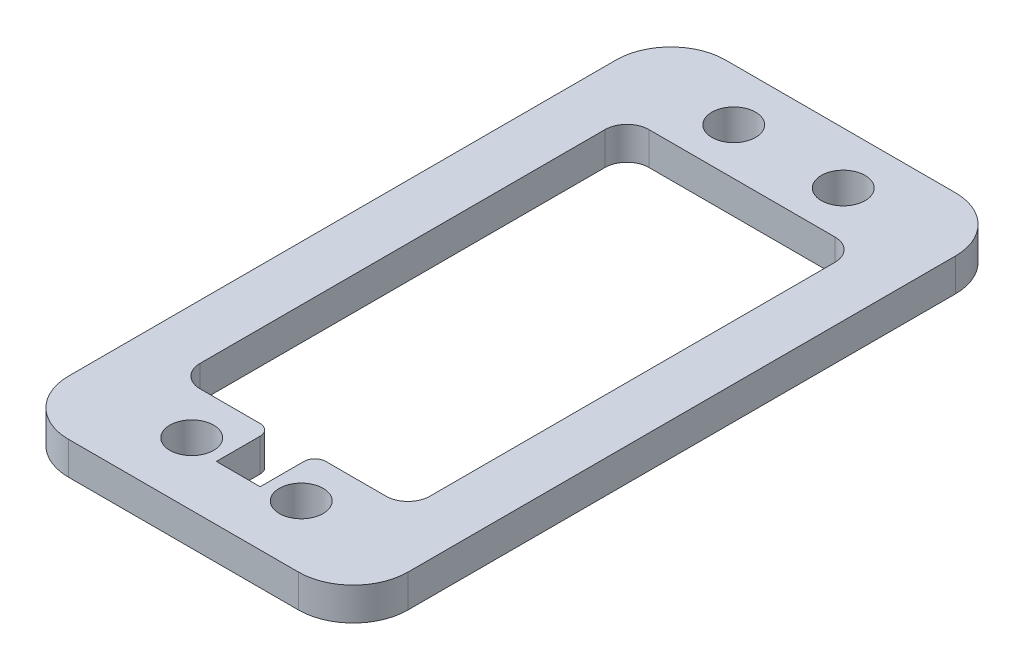
from build123d import *

# Parameters (mm, degrees)
SKETCH1_R           = 2
BOSS_EXTRUDE1_DEPTH = 3


with BuildPart() as part:
    # Sketch1 → Boss-Extrude1 (new body)
    with BuildSketch(Plane(origin=(0, 0, 0), x_dir=(1, 0, 0), z_dir=(0, 1, 0))):
        with BuildLine():
            ThreePointArc((-15.5, 34.4), (-14.035533906, 37.935533906), (-10.5, 39.4))
            Line((-10.5, 39.4), (10.5, 39.4))
            ThreePointArc((10.5, 39.4), (14.035533906, 37.935533906), (15.5, 34.4))
            Line((15.5, 34.4), (15.5, -15.6))
            ThreePointArc((15.5, -15.6), (14.035533906, -19.135533906), (10.5, -20.6))
            Line((10.5, -20.6), (-10.5, -20.6))
            ThreePointArc((-10.5, -20.6), (-14.035533906, -19.135533906), (-15.5, -15.6))
            Line((-15.5, -15.6), (-15.5, 34.4))
        make_face()
        with Locations(Location((5, -14.85, 0), (0, 0, 270))):
            Circle(SKETCH1_R, mode=Mode.SUBTRACT)
        with Locations(Location((-5, -14.85, 0), (0, 0, 270))):
            Circle(SKETCH1_R, mode=Mode.SUBTRACT)
        with Locations(Location((5, 34.65, 0), (0, 0, 270))):
            Circle(SKETCH1_R, mode=Mode.SUBTRACT)
        with Locations(Location((-5, 34.65, 0), (0, 0, 270))):
            Circle(SKETCH1_R, mode=Mode.SUBTRACT)
        with BuildLine():
            ThreePointArc((-3, -10.6), (-2.292893219, -10.892893219), (-2, -11.6))
            Line((-2, -11.6), (-2, -15.6))
            Line((-2, -15.6), (2, -15.6))
            Line((2, -15.6), (2, -11.6))
            ThreePointArc((2, -11.6), (2.292893219, -10.892893219), (3, -10.6))
            Line((3, -10.6), (8.5, -10.6))
            ThreePointArc((8.5, -10.6), (9.914213562, -10.014213562), (10.5, -8.6))
            Line((10.5, -8.6), (10.5, 28.4))
            ThreePointArc((10.5, 28.4), (9.914213562, 29.814213562), (8.5, 30.4))
            Line((8.5, 30.4), (-8.5, 30.4))
            ThreePointArc((-8.5, 30.4), (-9.914213562, 29.814213562), (-10.5, 28.4))
            Line((-10.5, 28.4), (-10.5, -8.6))
            ThreePointArc((-10.5, -8.6), (-9.914213562, -10.014213562), (-8.5, -10.6))
            Line((-8.5, -10.6), (-3, -10.6))
        make_face(mode=Mode.SUBTRACT)
    extrude(amount=BOSS_EXTRUDE1_DEPTH)


solid = part.part
